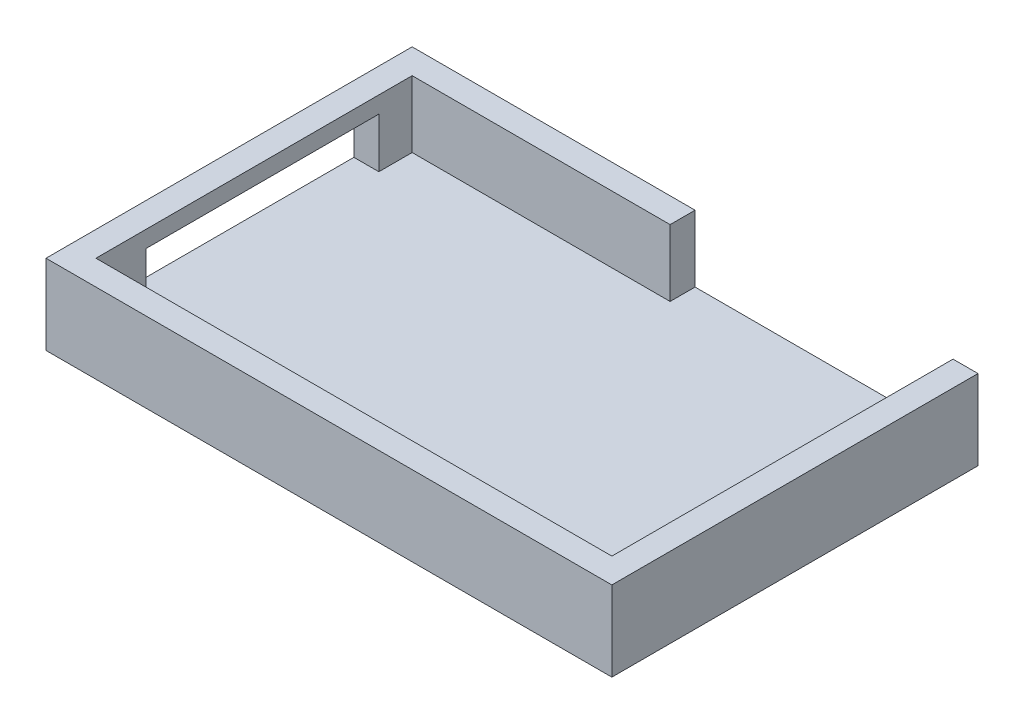
from build123d import *

# Parameters (mm, degrees)
CROQUIS2_W              = 170
CROQUIS2_H              = 110
SALIENTE_EXTRUIR1_DEPTH = 4
CROQUIS3_W              = 170
CROQUIS3_H              = 110
CROQUIS3_W_2            = 155
CROQUIS3_H_2            = 95
SALIENTE_EXTRUIR2_DEPTH = 20
CROQUIS4_W              = 70
CROQUIS4_H              = 15
CORTAR_EXTRUIR1_DEPTH   = 20
CROQUIS5_W              = 77.5
CROQUIS5_H              = 20
CORTAR_EXTRUIR2_DEPTH   = 20


with BuildPart() as part:
    # Croquis2 → Saliente-Extruir1 (new body)
    with BuildSketch(Plane(origin=(0, 0, 0), x_dir=(1, 0, 0), z_dir=(0, 1, 0))):
        Rectangle(CROQUIS2_W, CROQUIS2_H)
    extrude(amount=SALIENTE_EXTRUIR1_DEPTH)

    # Croquis3 → Saliente-Extruir2 (add)
    with BuildSketch(Plane(origin=(0, 4, 0), x_dir=(1, 0, 0), z_dir=(0, 1, 0))):
        Rectangle(CROQUIS3_W, CROQUIS3_H)
        Rectangle(CROQUIS3_W_2, CROQUIS3_H_2, mode=Mode.SUBTRACT)
    extrude(amount=SALIENTE_EXTRUIR2_DEPTH)

    # Croquis4 → Cortar-Extruir1 (cut)
    with BuildSketch(Plane(origin=(-77.5, 0, 0), x_dir=(0, 0, -1), z_dir=(1, 0, 0))):
        with Locations((2.5, 11.5)):
            Rectangle(CROQUIS4_W, CROQUIS4_H)
    extrude(amount=-CORTAR_EXTRUIR1_DEPTH, mode=Mode.SUBTRACT)

    # Croquis5 → Cortar-Extruir2 (cut)
    with BuildSketch(Plane.XY.offset(-47.5)):
        with Locations((38.75, 14)):
            Rectangle(CROQUIS5_W, CROQUIS5_H)
    extrude(amount=-CORTAR_EXTRUIR2_DEPTH, mode=Mode.SUBTRACT)


solid = part.part
